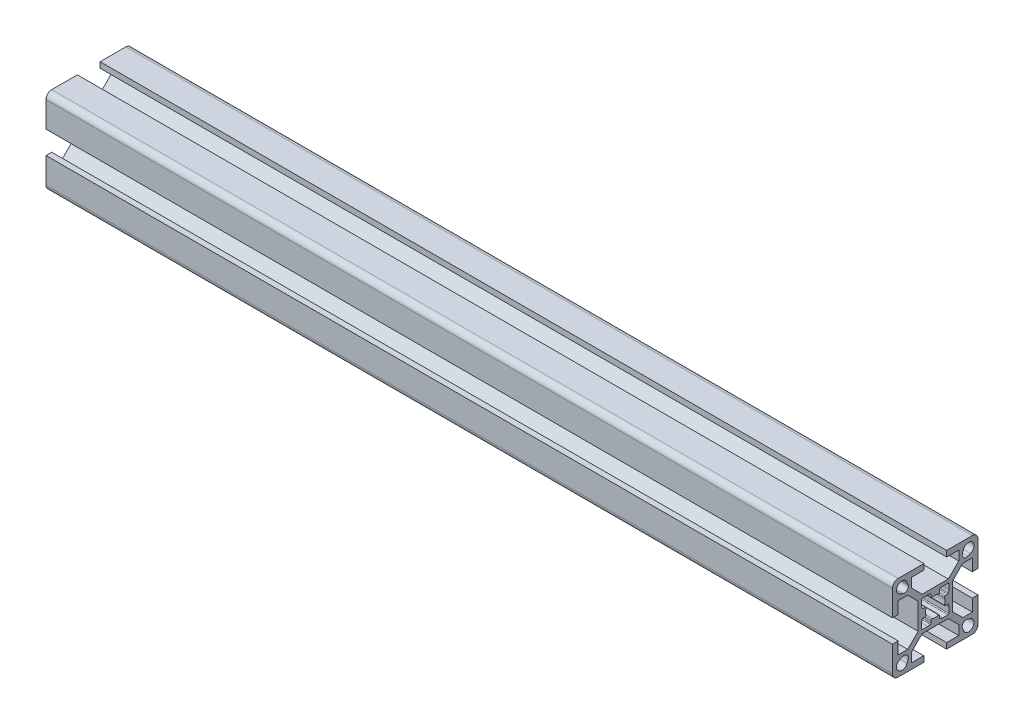
from build123d import *

# Parameters (mm, degrees)
BOSS_EXTRUDE1_DEPTH = 297


with BuildPart() as part:
    # Sketch1 → Boss-Extrude1 (new body)
    with BuildSketch(Plane(origin=(0, 0, 0), x_dir=(0, 0, -1), z_dir=(1, 0, 0))):
        with BuildLine():
            Line((-15, 13), (-15, 4))
            Line((-15, 4), (-13, 4))
            Line((-13, 4), (-13, 8.25))
            Line((-13, 8.25), (-9.664213562, 8.25))
            Line((-9.664213562, 8.25), (-6, 4.585786438))
            Line((-6, 4.585786438), (-6, -4.585786438))
            Line((-6, -4.585786438), (-9.664213562, -8.25))
            Line((-9.664213562, -8.25), (-13, -8.25))
            Line((-13, -8.25), (-13, -4))
            Line((-13, -4), (-15, -4))
            Line((-15, -4), (-15, -13))
            ThreePointArc((-15, -13), (-14.414213562, -14.414213562), (-13, -15))
            Line((-13, -15), (-4, -15))
            Line((-4, -15), (-4, -13))
            Line((-4, -13), (-8.25, -13))
            Line((-8.25, -13), (-8.25, -9.664213562))
            Line((-8.25, -9.664213562), (-4.585786438, -6))
            Line((-4.585786438, -6), (4.585786438, -6))
            Line((4.585786438, -6), (8.25, -9.664213562))
            Line((8.25, -9.664213562), (8.25, -13))
            Line((8.25, -13), (4, -13))
            Line((4, -13), (4, -15))
            Line((4, -15), (13, -15))
            ThreePointArc((13, -15), (14.414213562, -14.414213562), (15, -13))
            Line((15, -13), (15, -4))
            Line((15, -4), (13, -4))
            Line((13, -4), (13, -8.25))
            Line((13, -8.25), (9.664213562, -8.25))
            Line((9.664213562, -8.25), (6, -4.585786438))
            Line((6, -4.585786438), (6, 4.585786438))
            Line((6, 4.585786438), (9.664213562, 8.25))
            Line((9.664213562, 8.25), (13, 8.25))
            Line((13, 8.25), (13, 4))
            Line((13, 4), (15, 4))
            Line((15, 4), (15, 13))
            ThreePointArc((15, 13), (14.414213562, 14.414213562), (13, 15))
            Line((13, 15), (4, 15))
            Line((4, 15), (4, 13))
            Line((4, 13), (8.25, 13))
            Line((8.25, 13), (8.25, 9.664213562))
            Line((8.25, 9.664213562), (4.585786438, 6))
            Line((4.585786438, 6), (-4.585786438, 6))
            Line((-4.585786438, 6), (-8.25, 9.664213562))
            Line((-8.25, 9.664213562), (-8.25, 13))
            Line((-8.25, 13), (-4, 13))
            Line((-4, 13), (-4, 15))
            Line((-4, 15), (-13, 15))
            ThreePointArc((-13, 15), (-14.414213562, 14.414213562), (-15, 13))
        make_face()
        with BuildLine():
            Line((-9.539070071, 11.338915743), (-9.918883282, 12.361530981))
            ThreePointArc((-9.918883282, 12.361530981), (-13.043502884, 13.043502884), (-12.361530981, 9.918883282))
            Line((-12.361530981, 9.918883282), (-11.338915743, 9.539070071))
            ThreePointArc((-11.338915743, 9.539070071), (-9.861522369, 9.861522369), (-9.539070071, 11.338915743))
        make_face(mode=Mode.SUBTRACT)
        with BuildLine():
            Line((9.918883282, 12.361530981), (9.539070071, 11.338915743))
            ThreePointArc((9.539070071, 11.338915743), (9.861522369, 9.861522369), (11.338915743, 9.539070071))
            Line((11.338915743, 9.539070071), (12.361530981, 9.918883282))
            ThreePointArc((12.361530981, 9.918883282), (13.043502884, 13.043502884), (9.918883282, 12.361530981))
        make_face(mode=Mode.SUBTRACT)
        with BuildLine():
            Line((12.361530981, -9.918883282), (11.338915743, -9.539070071))
            ThreePointArc((11.338915743, -9.539070071), (9.861522369, -9.861522369), (9.539070071, -11.338915743))
            Line((9.539070071, -11.338915743), (9.918883282, -12.361530981))
            ThreePointArc((9.918883282, -12.361530981), (13.043502884, -13.043502884), (12.361530981, -9.918883282))
        make_face(mode=Mode.SUBTRACT)
        with BuildLine():
            Line((-11.338915743, -9.539070071), (-12.361530981, -9.918883282))
            ThreePointArc((-12.361530981, -9.918883282), (-13.043502884, -13.043502884), (-9.918883282, -12.361530981))
            Line((-9.918883282, -12.361530981), (-9.539070071, -11.338915743))
            ThreePointArc((-9.539070071, -11.338915743), (-9.861522369, -9.861522369), (-11.338915743, -9.539070071))
        make_face(mode=Mode.SUBTRACT)
        with BuildLine():
            Line((-4.8, -2.644433572), (-4.8, -4.5))
            ThreePointArc((-4.8, -4.5), (-4.712132034, -4.712132034), (-4.5, -4.8))
            Line((-4.5, -4.8), (-2.644433572, -4.8))
            ThreePointArc((-2.644433572, -4.8), (-2.615679847, -4.79861886), (-2.587190874, -4.794488155))
            Line((-2.587190874, -4.794488155), (-1.742757301, -4.630346896))
            ThreePointArc((-1.742757301, -4.630346896), (-1.568512625, -4.526682207), (-1.5, -4.335858741))
            Line((-1.5, -4.335858741), (-1.5, -3.5))
            ThreePointArc((-1.5, -3.5), (-1.374371458, -3.255879959), (-1.102702703, -3.216216216))
            ThreePointArc((-1.102702703, -3.216216216), (0, -3.4), (1.102702703, -3.216216216))
            ThreePointArc((1.102702703, -3.216216216), (1.374371458, -3.255879959), (1.5, -3.5))
            Line((1.5, -3.5), (1.5, -4.335858741))
            ThreePointArc((1.5, -4.335858741), (1.568512625, -4.526682207), (1.742757301, -4.630346896))
            Line((1.742757301, -4.630346896), (2.587190874, -4.794488155))
            ThreePointArc((2.587190874, -4.794488155), (2.615679847, -4.79861886), (2.644433572, -4.8))
            Line((2.644433572, -4.8), (4.5, -4.8))
            ThreePointArc((4.5, -4.8), (4.712132034, -4.712132034), (4.8, -4.5))
            Line((4.8, -4.5), (4.8, -2.644433572))
            ThreePointArc((4.8, -2.644433572), (4.79861886, -2.615679847), (4.794488155, -2.587190874))
            Line((4.794488155, -2.587190874), (4.630346896, -1.742757301))
            ThreePointArc((4.630346896, -1.742757301), (4.526682207, -1.568512625), (4.335858741, -1.5))
            Line((4.335858741, -1.5), (3.5, -1.5))
            ThreePointArc((3.5, -1.5), (3.255879959, -1.374371458), (3.216216216, -1.102702703))
            ThreePointArc((3.216216216, -1.102702703), (3.4, 0), (3.216216216, 1.102702703))
            ThreePointArc((3.216216216, 1.102702703), (3.255879959, 1.374371458), (3.5, 1.5))
            Line((3.5, 1.5), (4.335858741, 1.5))
            ThreePointArc((4.335858741, 1.5), (4.526682207, 1.568512625), (4.630346896, 1.742757301))
            Line((4.630346896, 1.742757301), (4.794488155, 2.587190874))
            ThreePointArc((4.794488155, 2.587190874), (4.79861886, 2.615679847), (4.8, 2.644433572))
            Line((4.8, 2.644433572), (4.8, 4.5))
            ThreePointArc((4.8, 4.5), (4.712132034, 4.712132034), (4.5, 4.8))
            Line((4.5, 4.8), (2.644433572, 4.8))
            ThreePointArc((2.644433572, 4.8), (2.615679847, 4.79861886), (2.587190874, 4.794488155))
            Line((2.587190874, 4.794488155), (1.742757301, 4.630346896))
            ThreePointArc((1.742757301, 4.630346896), (1.568512625, 4.526682207), (1.5, 4.335858741))
            Line((1.5, 4.335858741), (1.5, 3.5))
            ThreePointArc((1.5, 3.5), (1.374371458, 3.255879959), (1.102702703, 3.216216216))
            ThreePointArc((1.102702703, 3.216216216), (0, 3.4), (-1.102702703, 3.216216216))
            ThreePointArc((-1.102702703, 3.216216216), (-1.374371458, 3.255879959), (-1.5, 3.5))
            Line((-1.5, 3.5), (-1.5, 4.335858741))
            ThreePointArc((-1.5, 4.335858741), (-1.568512625, 4.526682207), (-1.742757301, 4.630346896))
            Line((-1.742757301, 4.630346896), (-2.587190874, 4.794488155))
            ThreePointArc((-2.587190874, 4.794488155), (-2.615679847, 4.79861886), (-2.644433572, 4.8))
            Line((-2.644433572, 4.8), (-4.5, 4.8))
            ThreePointArc((-4.5, 4.8), (-4.712132034, 4.712132034), (-4.8, 4.5))
            Line((-4.8, 4.5), (-4.8, 2.644433572))
            ThreePointArc((-4.8, 2.644433572), (-4.79861886, 2.615679847), (-4.794488155, 2.587190874))
            Line((-4.794488155, 2.587190874), (-4.630346896, 1.742757301))
            ThreePointArc((-4.630346896, 1.742757301), (-4.526682207, 1.568512625), (-4.335858741, 1.5))
            Line((-4.335858741, 1.5), (-3.5, 1.5))
            ThreePointArc((-3.5, 1.5), (-3.255879959, 1.374371458), (-3.216216216, 1.102702703))
            ThreePointArc((-3.216216216, 1.102702703), (-3.4, 0), (-3.216216216, -1.102702703))
            ThreePointArc((-3.216216216, -1.102702703), (-3.255879959, -1.374371458), (-3.5, -1.5))
            Line((-3.5, -1.5), (-4.335858741, -1.5))
            ThreePointArc((-4.335858741, -1.5), (-4.526682207, -1.568512625), (-4.630346896, -1.742757301))
            Line((-4.630346896, -1.742757301), (-4.794488155, -2.587190874))
            ThreePointArc((-4.794488155, -2.587190874), (-4.79861886, -2.615679847), (-4.8, -2.644433572))
        make_face(mode=Mode.SUBTRACT)
    extrude(amount=BOSS_EXTRUDE1_DEPTH)


solid = part.part
